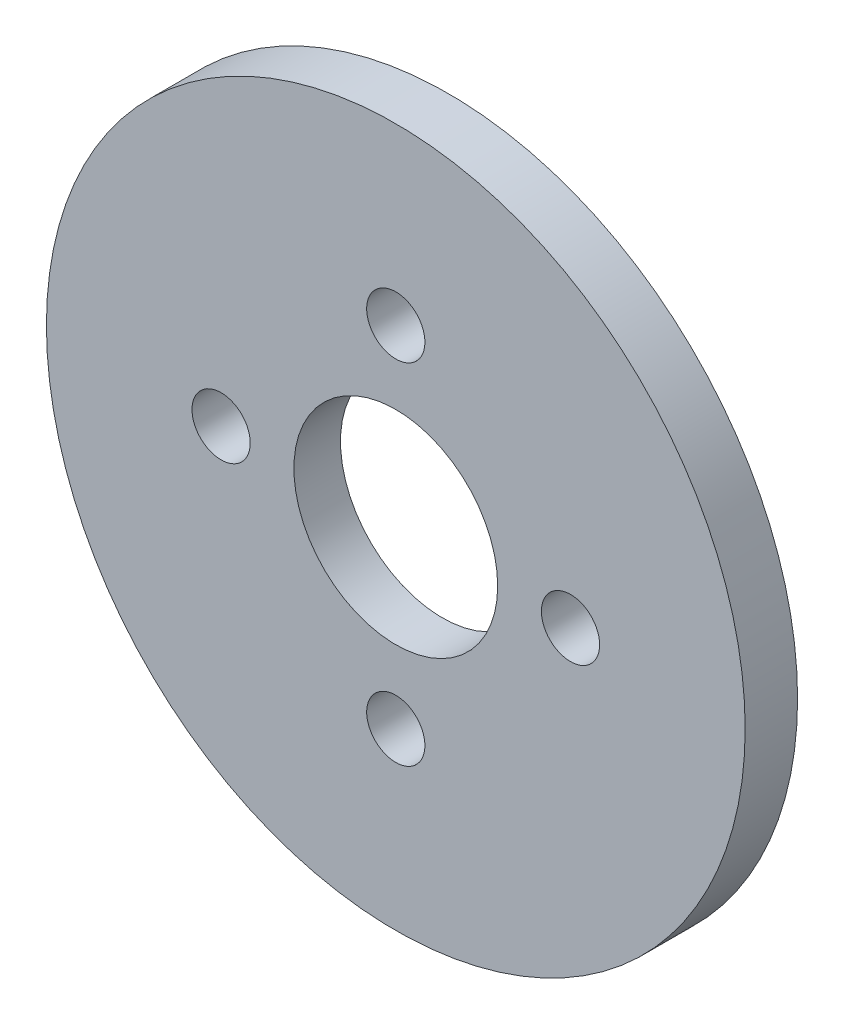
from build123d import *

# Parameters (mm, degrees)
SKETCH_1_R         = 30
SKETCH_1_R_2       = 8.75
EXTRUDE_1_DEPTH    = 4
HOLE_WIZARD_M6_1_D = 5


with BuildPart() as part:
    # 草图1 → 凸台-拉伸1 (new body)
    with BuildSketch(Plane.XY):
        Circle(SKETCH_1_R)
        Circle(SKETCH_1_R_2, mode=Mode.SUBTRACT)
    extrude(amount=EXTRUDE_1_DEPTH)

    # 草图4 → 旋转1 (revolve)
    with BuildSketch(Plane(origin=(0, 0, 0), x_dir=(1, 0, 0), z_dir=(0, 1, 0)), mode=Mode.PRIVATE) as revolve_1_sk:
        Polygon((-30, 0), (-30, 0.5), (-20, 0.5), (-18, 0), align=None)
    revolve(revolve_1_sk.sketch.rotate(Axis((0, 0, 0), (0, 0, -1)), 180), axis=Axis((0, 0, 0), (0, 0, -1)))

    # M6 螺纹孔1 (through all)
    with Locations(Plane.XY.offset(4)):
        with Locations((0, 15), (15, 0), (0, -15), (-15, 0)):
            Hole(HOLE_WIZARD_M6_1_D / 2)


solid = part.part
